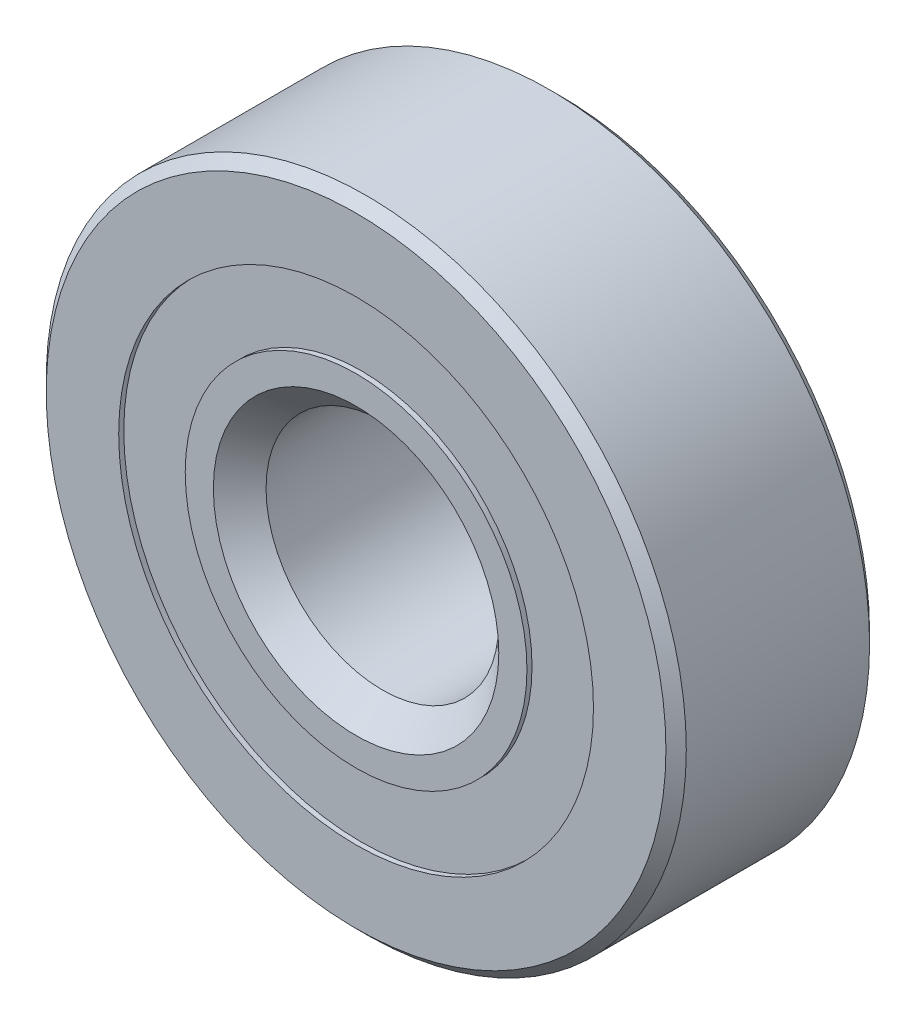
from build123d import *

# Parameters (mm, degrees)
CIRPATTERN1_COUNT = 12
SKETCH5_W         = 1.635478413
SKETCH5_H         = 2.286391385


with BuildPart() as part:
    # Sketch1 → Revolve1 (revolve)
    with BuildSketch(Plane(origin=(0, 0, 0), x_dir=(0, 0, -1), z_dir=(1, 0, 0))):
        with BuildLine():
            Line((3.15, 11), (-3.15, 11))
            Line((-3.15, 11), (-3.5, 10.65))
            Line((-3.5, 10.65), (-3.5, 8.159340659))
            Line((-3.5, 8.159340659), (-1.555555556, 8.159340659))
            ThreePointArc((-1.555555556, 8.159340659), (0, 9.189521587), (1.555555556, 8.159340659))
            Line((1.555555556, 8.159340659), (3.5, 8.159340659))
            Line((3.5, 8.159340659), (3.5, 10.65))
            Line((3.5, 10.65), (3.15, 11))
        make_face()
    revolve(axis=Axis((0, 0, 3.5), (0, 0, -1)))


with BuildPart() as body_2:
    # Sketch3 → Revolve3 (revolve)
    with BuildSketch(Plane(origin=(0, 0, 0), x_dir=(0, 0, -1), z_dir=(1, 0, 0))):
        with BuildLine():
            Line((-3.325, 5.697949274), (-2.532289933, 4.905239207))
            Line((-2.532289933, 4.905239207), (0, 4.905239207))
            Line((0, 4.905239207), (0, 5.810478413))
            ThreePointArc((0, 5.810478413), (0.932875371, 6.091374168), (1.555555556, 6.840659341))
            Line((1.555555556, 6.840659341), (3.5, 6.840659341))
            Line((3.5, 6.840659341), (3.5, 4.35))
            Line((3.5, 4.35), (3.15, 4))
            Line((3.15, 4), (-2.594760793, 4))
            Line((-2.594760793, 4), (-3.5, 4.905239207))
            Line((-3.5, 4.905239207), (-3.5, 5.872949274))
            Line((-3.5, 5.872949274), (-3.325, 5.872949274))
            Line((-3.325, 5.872949274), (-3.325, 5.697949274))
        make_face()
    revolve(axis=Axis((0, 0, 3.5), (0, 0, -1)))


with BuildPart() as body_3:
    # Sketch4 → Revolve4 (revolve)
    with BuildSketch(Plane(origin=(0, 0, 0), x_dir=(0, 0, -1), z_dir=(1, 0, 0))):
        with BuildLine():
            Line((-1.689521587, 7.5), (1.689521587, 7.5))
            ThreePointArc((1.689521587, 7.5), (0, 9.189521587), (-1.689521587, 7.5))
        make_face()
    revolve(axis=Axis((0, 7.5, 1.689521587), (0, 0, -1)))


with BuildPart() as cirpattern1_1:
    # CirPattern1: pattern copy
    add(body_3.part.rotate(Axis((0, 0, -3.5), (0, 0, 1)), 1 * 360 / CIRPATTERN1_COUNT))


with BuildPart() as cirpattern1_2:
    # CirPattern1: pattern copy
    add(body_3.part.rotate(Axis((0, 0, -3.5), (0, 0, 1)), 2 * 360 / CIRPATTERN1_COUNT))


with BuildPart() as cirpattern1_3:
    # CirPattern1: pattern copy
    add(body_3.part.rotate(Axis((0, 0, -3.5), (0, 0, 1)), 3 * 360 / CIRPATTERN1_COUNT))


with BuildPart() as cirpattern1_4:
    # CirPattern1: pattern copy
    add(body_3.part.rotate(Axis((0, 0, -3.5), (0, 0, 1)), 4 * 360 / CIRPATTERN1_COUNT))


with BuildPart() as cirpattern1_5:
    # CirPattern1: pattern copy
    add(body_3.part.rotate(Axis((0, 0, -3.5), (0, 0, 1)), 5 * 360 / CIRPATTERN1_COUNT))


with BuildPart() as cirpattern1_6:
    # CirPattern1: pattern copy
    add(body_3.part.rotate(Axis((0, 0, -3.5), (0, 0, 1)), 6 * 360 / CIRPATTERN1_COUNT))


with BuildPart() as cirpattern1_7:
    # CirPattern1: pattern copy
    add(body_3.part.rotate(Axis((0, 0, -3.5), (0, 0, 1)), 7 * 360 / CIRPATTERN1_COUNT))


with BuildPart() as cirpattern1_8:
    # CirPattern1: pattern copy
    add(body_3.part.rotate(Axis((0, 0, -3.5), (0, 0, 1)), 8 * 360 / CIRPATTERN1_COUNT))


with BuildPart() as cirpattern1_9:
    # CirPattern1: pattern copy
    add(body_3.part.rotate(Axis((0, 0, -3.5), (0, 0, 1)), 9 * 360 / CIRPATTERN1_COUNT))


with BuildPart() as cirpattern1_10:
    # CirPattern1: pattern copy
    add(body_3.part.rotate(Axis((0, 0, -3.5), (0, 0, 1)), 10 * 360 / CIRPATTERN1_COUNT))


with BuildPart() as cirpattern1_11:
    # CirPattern1: pattern copy
    add(body_3.part.rotate(Axis((0, 0, -3.5), (0, 0, 1)), 11 * 360 / CIRPATTERN1_COUNT))


with BuildPart() as body_15:
    # Sketch5 → Revolve5 (revolve)
    with BuildSketch(Plane(origin=(0, 0, 0), x_dir=(0, 0, -1), z_dir=(1, 0, 0))):
        with Locations((-2.507260794, 7.016144967)):
            Rectangle(SKETCH5_W, SKETCH5_H)
        with Locations((2.507260794, 7.016144967)):
            Rectangle(SKETCH5_W, SKETCH5_H)
    revolve(axis=Axis((0, 0, 3.5), (0, 0, -1)))


solid = Compound([part.part, body_2.part, body_3.part, cirpattern1_1.part, cirpattern1_2.part, cirpattern1_3.part, cirpattern1_4.part, cirpattern1_5.part, cirpattern1_6.part, cirpattern1_7.part, cirpattern1_8.part, cirpattern1_9.part, cirpattern1_10.part, cirpattern1_11.part, body_15.part])
